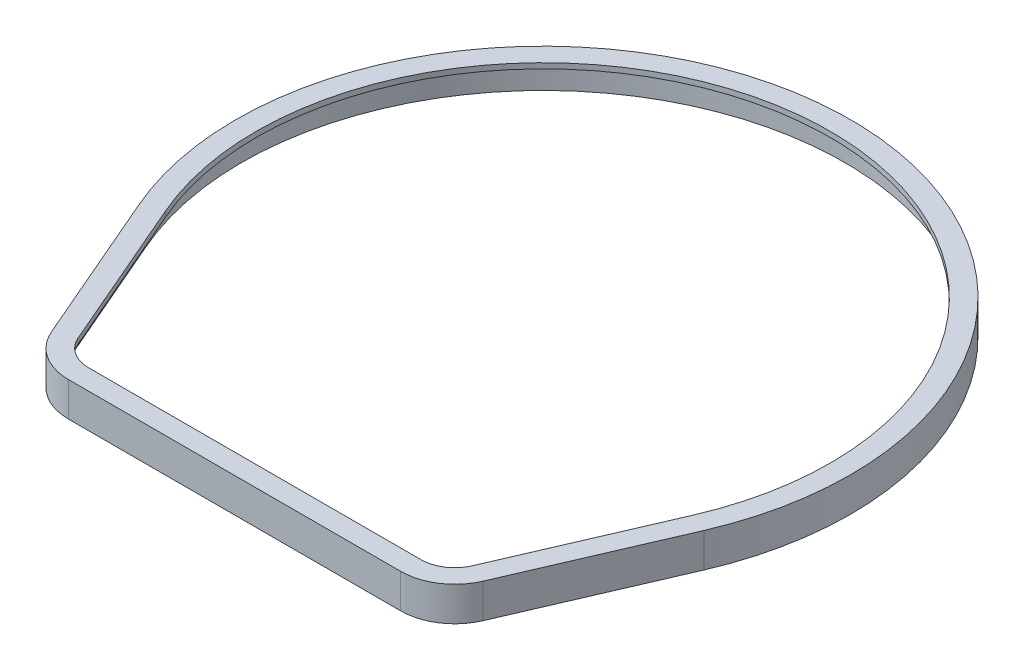
from build123d import *

# Parameters (mm, degrees)
BOSS_EXTRUDE1_DEPTH = 6
BOSS_EXTRUDE2_DEPTH = 1.1


with BuildPart() as part:
    # Sketch1 → Boss-Extrude1 (new body)
    with BuildSketch(Plane(origin=(0, 0, 0), x_dir=(1, 0, 0), z_dir=(0, 1, 0))):
        with BuildLine():
            ThreePointArc((34.422746677, -63.95), (40.577345115, -62.107399108), (44.706859879, -57.185878226))
            Line((44.706859879, -57.185878226), (58.490893839, -25.229057412))
            ThreePointArc((58.490893839, -25.229057412), (0, 63.7), (-58.490893839, -25.229057412))
            Line((-58.490893839, -25.229057412), (-44.706859879, -57.185878226))
            ThreePointArc((-44.706859879, -57.185878226), (-40.577345115, -62.107399108), (-34.422746677, -63.95))
            Line((-34.422746677, -63.95), (34.422746677, -63.95))
        make_face()
        with BuildLine():
            Line((34.422746677, -62.75), (-34.422746677, -62.75))
            ThreePointArc((-34.422746677, -62.75), (-39.917923854, -61.104820632), (-43.604990608, -56.710605559))
            Line((-43.604990608, -56.710605559), (-57.389024568, -24.753784745))
            ThreePointArc((-57.389024568, -24.753784745), (-12.637957994, 61.208921063), (62.5, 0))
            ThreePointArc((62.5, 0), (61.208921063, -12.637957994), (57.389024568, -24.753784745))
            Line((57.389024568, -24.753784745), (43.604990608, -56.710605559))
            ThreePointArc((43.604990608, -56.710605559), (39.917923854, -61.104820632), (34.422746677, -62.75))
        make_face(mode=Mode.SUBTRACT)
    extrude(amount=BOSS_EXTRUDE1_DEPTH)

    # Sketch3 → Boss-Extrude2 (add)
    with BuildSketch(Plane(origin=(0, 6, 0), x_dir=(1, 0, 0), z_dir=(0, 1, 0))):
        with BuildLine():
            Line((-58.490893839, -25.229057412), (-44.706859879, -57.185878226))
            ThreePointArc((-44.706859879, -57.185878226), (-40.577345115, -62.107399108), (-34.422746677, -63.95))
            Line((-34.422746677, -63.95), (34.422746677, -63.95))
            ThreePointArc((34.422746677, -63.95), (40.577345115, -62.107399108), (44.706859879, -57.185878226))
            Line((44.706859879, -57.185878226), (58.490893839, -25.229057412))
            ThreePointArc((58.490893839, -25.229057412), (0, 63.7), (-58.490893839, -25.229057412))
        make_face()
        with BuildLine():
            Line((40.850317428, -55.522423891), (54.634351388, -23.565603077))
            ThreePointArc((54.634351388, -23.565603077), (0, 59.5), (-54.634351388, -23.565603077))
            Line((-54.634351388, -23.565603077), (-40.850317428, -55.522423891))
            ThreePointArc((-40.850317428, -55.522423891), (-38.269370701, -58.598374443), (-34.422746677, -59.75))
            Line((-34.422746677, -59.75), (34.422746677, -59.75))
            ThreePointArc((34.422746677, -59.75), (38.269370701, -58.598374443), (40.850317428, -55.522423891))
        make_face(mode=Mode.SUBTRACT)
    extrude(amount=BOSS_EXTRUDE2_DEPTH)


solid = part.part
